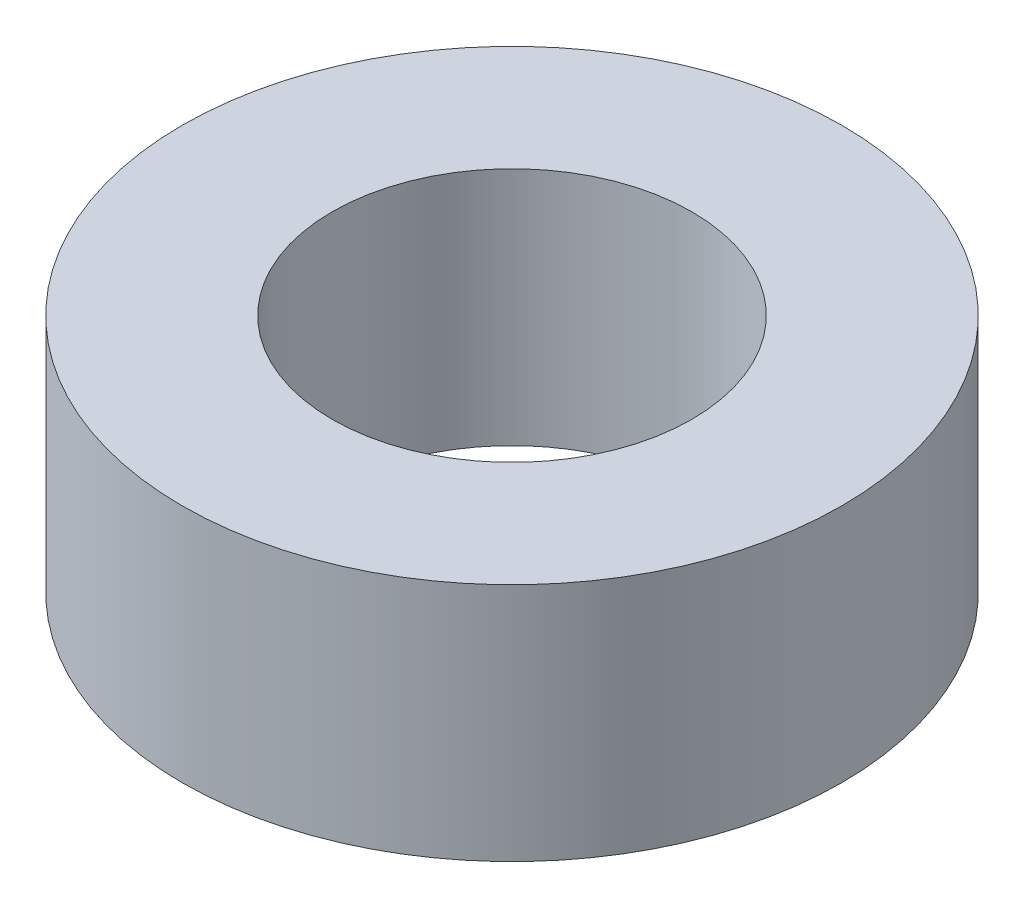
from build123d import *

# Parameters (mm, degrees)
SKETCH1_R           = 2.75
SKETCH1_R_2         = 1.5
BOSS_EXTRUDE1_DEPTH = 2


with BuildPart() as part:
    # Sketch1 → Boss-Extrude1 (new body)
    with BuildSketch(Plane(origin=(0, 0, 0), x_dir=(1, 0, 0), z_dir=(0, 1, 0))):
        with Locations(Location((0, 0, 0), (0, 0, 270))):
            Circle(SKETCH1_R)
        with Locations(Location((0, 0, 0), (0, 0, 270))):
            Circle(SKETCH1_R_2, mode=Mode.SUBTRACT)
    extrude(amount=BOSS_EXTRUDE1_DEPTH)


solid = part.part
